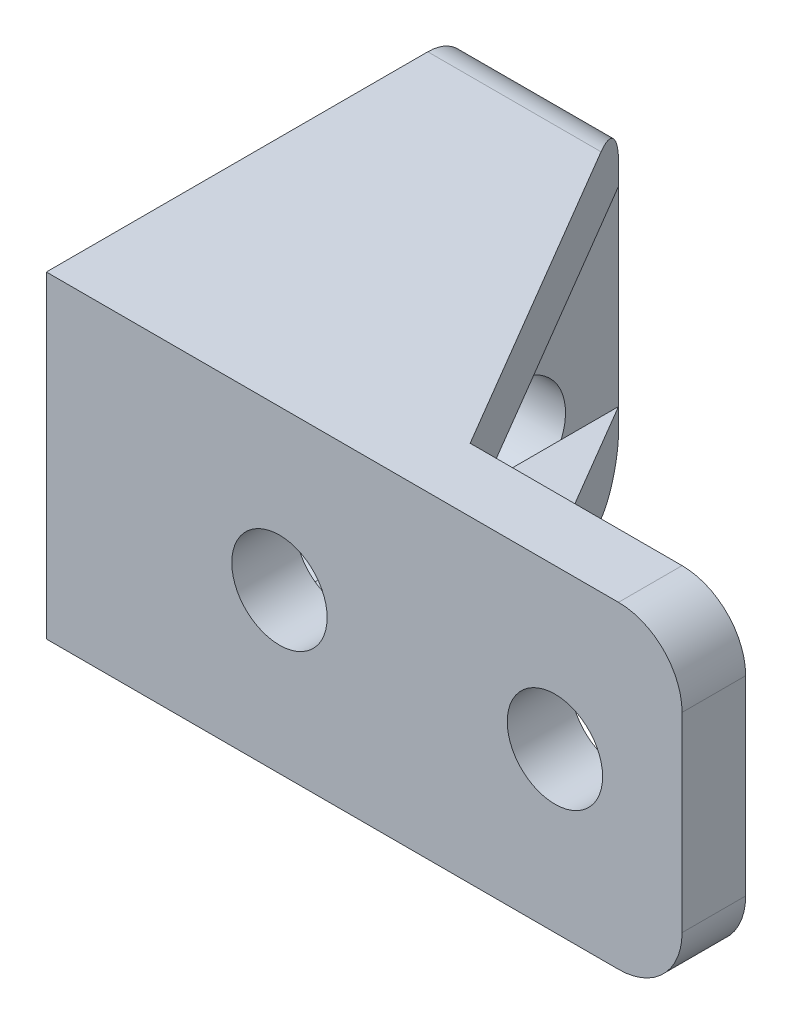
from build123d import *

# Parameters (mm, degrees)
SKETCH1_W           = 30
SKETCH1_H           = 3
SKETCH1_W_2         = 7
SKETCH1_H_2         = 17
BOSS_EXTRUDE1_DEPTH = 15
BOSS_EXTRUDE2_DEPTH = 3
BOSS_EXTRUDE3_START = -15
BOSS_EXTRUDE3_DEPTH = 3
SKETCH4_R           = 2.5
CUT_EXTRUDE1_DEPTH  = 7
SKETCH5_R           = 2.25
CUT_EXTRUDE2_DEPTH  = 7
FILLET3_R           = 3
FILLET4_R           = 2


with BuildPart() as part:
    # Sketch1 → Boss-Extrude1 (new body)
    with BuildSketch(Plane(origin=(0, 0, 0), x_dir=(1, 0, 0), z_dir=(0, 1, 0))):
        Rectangle(SKETCH1_W, SKETCH1_H)
        with Locations((-11.5, 10)):
            Rectangle(SKETCH1_W_2, SKETCH1_H_2)
    extrude(amount=BOSS_EXTRUDE1_DEPTH)

    # Sketch3 → Boss-Extrude2 (add)
    with BuildSketch(Plane(origin=(0, 15, 0), x_dir=(1, 0, 0), z_dir=(0, 1, 0))):
        Polygon((-8, 18.5), (2, 1.5), (-8, 1.5), align=None)
    extrude(amount=-BOSS_EXTRUDE2_DEPTH)

    # Sketch3<3> → Boss-Extrude3 (add)
    with BuildSketch(Plane(origin=(0, 15, 0), x_dir=(1, 0, 0), z_dir=(0, 1, 0)).offset(BOSS_EXTRUDE3_START)):
        Polygon((-8, 18.5), (2, 1.5), (-8, 1.5), align=None)
    extrude(amount=BOSS_EXTRUDE3_DEPTH)

    # Sketch4 → Cut-Extrude1 (cut)
    with BuildSketch(Plane.ZY.offset(15)):
        with Locations((-3.5, 11)):
            Circle(SKETCH4_R)
        with Locations((-13.5, 11)):
            Circle(SKETCH4_R)
        with Locations((-3.5, 4)):
            Circle(SKETCH4_R)
        with Locations((-13.5, 4)):
            Circle(SKETCH4_R)
    extrude(amount=-CUT_EXTRUDE1_DEPTH, mode=Mode.SUBTRACT)

    # Sketch5 → Cut-Extrude2 (cut)
    with BuildSketch(Plane(origin=(0, 0, -1.5), x_dir=(-1, 0, 0), z_dir=(0, 0, -1))):
        with Locations((-9, 7.5)):
            Circle(SKETCH5_R)
        with Locations((4, 7.5)):
            Circle(SKETCH5_R)
    extrude(amount=-CUT_EXTRUDE2_DEPTH, mode=Mode.SUBTRACT)

    # Fillet3
    fillet3_edges = [part.edges().sort_by_distance(p)[0] for p in [
        (15, 15, 0),
        (15, 0, 0),
    ]]
    fillet(fillet3_edges, radius=FILLET3_R)

    # Fillet4
    fillet4_edges = [part.edges().sort_by_distance(p)[0] for p in [
        (-11.5, 15, -18.5),
        (-11.5, 0, -18.5),
    ]]
    fillet(fillet4_edges, radius=FILLET4_R)


solid = part.part
